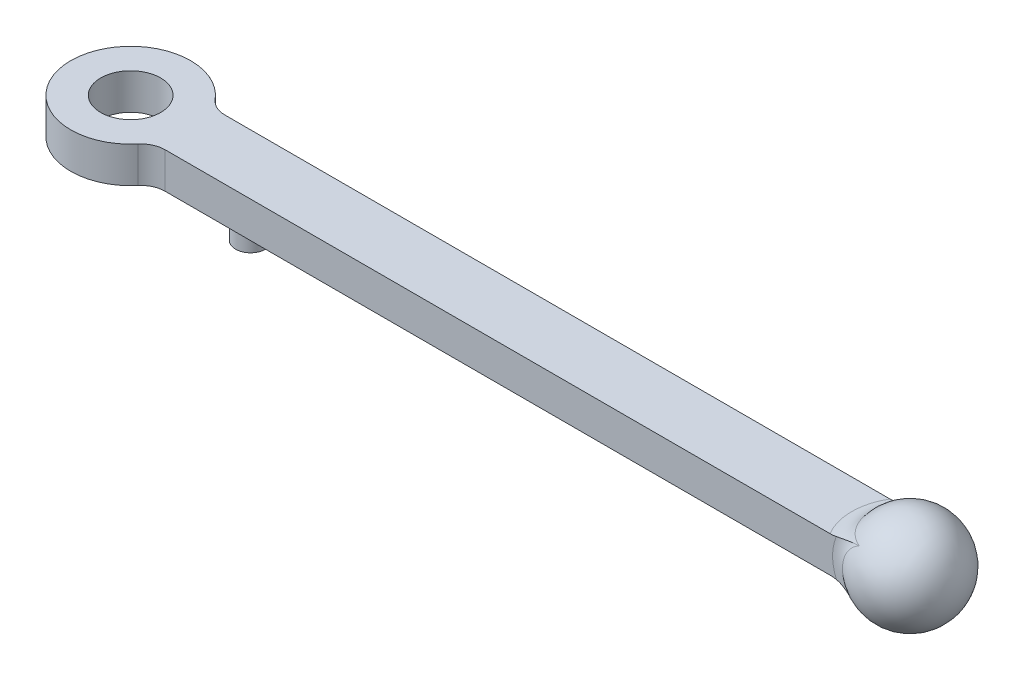
from build123d import *

# Parameters (mm, degrees)
SKETCH_1_R          = 10
SKETCH_1_R_2        = 4.99999999999999
SKETCH_1_W          = 121.3397459621556
SKETCH_1_H          = 9.99999999999998
EXTRUDE_1_DEPTH     = 6
FILLET_1_R          = 4
SKETCH_3_R          = 5
CUT_EXTRUDE_1_DEPTH = 6
SKETCH_4_R          = 2.4999999999999982
EXTRUDE_2_DEPTH     = 5


with BuildPart() as part:
    # 草图1 → 凸台-拉伸1 (new body)
    with BuildSketch(Plane(origin=(0, 0, 0), x_dir=(1, 0, 0), z_dir=(0, 1, 0))):
        Circle(SKETCH_1_R)
        with Locations((130, 0)):
            Circle(SKETCH_1_R_2)
        with Locations((69.3301270189222, 0)):
            Rectangle(SKETCH_1_W, SKETCH_1_H)
    extrude(amount=EXTRUDE_1_DEPTH)

    # 草图2 → 旋转6 (revolve)
    with BuildSketch(Plane(origin=(0, 3, 0), x_dir=(1, 0, 0), z_dir=(0, 1, 0)), mode=Mode.PRIVATE) as revolve_6_sk:
        with BuildLine():
            ThreePointArc((130, -4.999999999999993), (133.53553390593277, -3.5355339059327036), (135, 8.296e-14))
            Line((135, 0), (130, 0))
            Line((130, 0), (122, 0))
            ThreePointArc((121.99999999999999, 9.8e-16), (122.45149074362405, -2.6495297708096603), (123.75500200160165, -5.0000000000000915))
            Line((123.7550020016017, -4.99999999999999), (130, -4.99999999999999))
        make_face()
        with BuildLine():
            ThreePointArc((123.75500200160165, -5.0000000000000915), (132.64952977080966, -7.548509256375958), (138, -1.96e-15))
            Line((138, 0), (135, 0))
            ThreePointArc((135, 8.296e-14), (133.53553390593277, -3.5355339059327036), (130, -4.999999999999993))
            Line((130, -4.99999999999999), (123.7550020016017, -4.99999999999999))
        make_face()
        with BuildLine():
            ThreePointArc((130, -4.999999999999993), (133.53553390593277, -3.5355339059327036), (135, 8.296e-14))
            Line((135, 0), (130, 0))
            Line((130, 0), (122, 0))
            ThreePointArc((121.99999999999999, 9.8e-16), (122.45149074362405, -2.6495297708096603), (123.75500200160165, -5.0000000000000915))
            Line((123.7550020016017, -4.99999999999999), (130, -4.99999999999999))
        make_face()
    revolve(revolve_6_sk.sketch.rotate(Axis((130, 3, 0), (1, 0, 0)), 180), axis=Axis((130, 3, 0), (1, 0, 0)))

    # 圆角1
    fillet_1_edges = [part.edges().sort_by_distance(p)[0] for p in [
        (123.7550020016015, 3.0000000000000013, 4.99999999999999),
        (122.58380151290432, 6, 7.053e-14),
        (123.94998914244879, 4.548343832458719, -4.99999999999999),
        (122.58380151290432, 0, 6.78e-14),
        (8.66025403784439, 3, -4.99999999999999),
        (8.66025403784439, 3, 4.99999999999999),
    ]]
    fillet(fillet_1_edges, radius=FILLET_1_R)

    # 草图3 → 切除-拉伸1 (cut)
    with BuildSketch(Plane.XZ):
        with Locations(Location((0, 0, 0), (0, 0, 270))):
            Circle(SKETCH_3_R)
    extrude(amount=-CUT_EXTRUDE_1_DEPTH, mode=Mode.SUBTRACT)

    # 草图4 → 凸台-拉伸2 (add)
    with BuildSketch(Plane.XZ):
        with Locations(Location((20, 0, 0), (0, 0, 90))):
            Circle(SKETCH_4_R)
    extrude(amount=EXTRUDE_2_DEPTH)


solid = part.part
